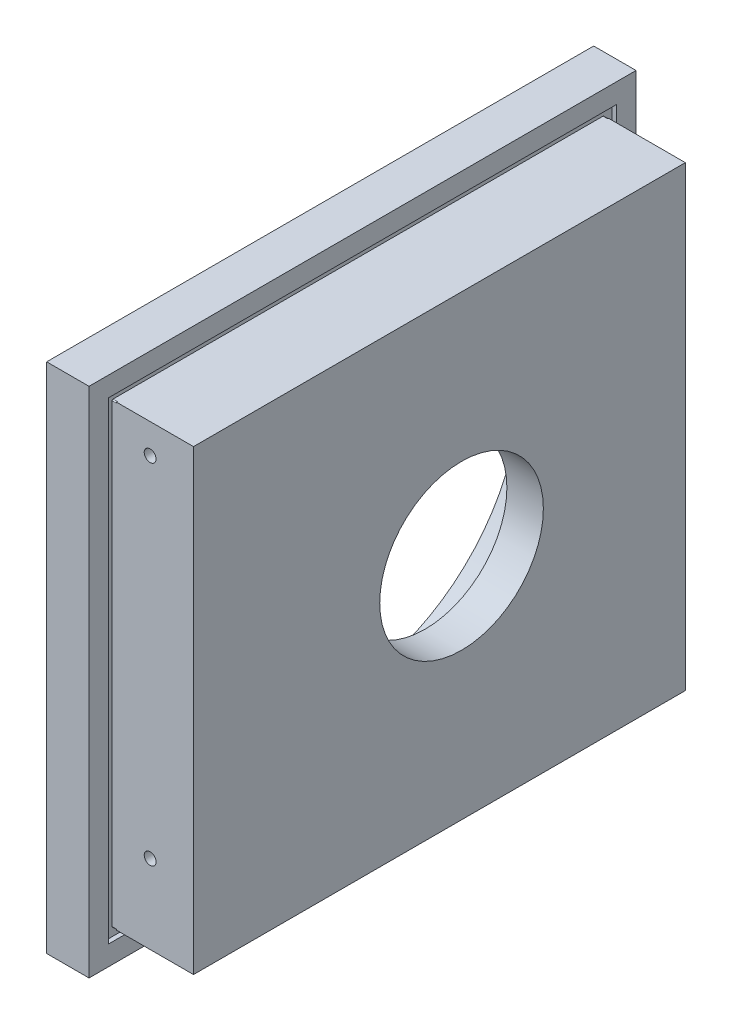
from build123d import *

# Parameters (mm, degrees)
SKETCH1_W                 = 300
SKETCH1_H                 = 260
BOSS_EXTRUDE1_DEPTH       = 60.5
SKETCH2_R                 = 90.45
CUT_EXTRUDE1_DEPTH        = 42
SKETCH9_R                 = 41.51
CUT_EXTRUDE9_DEPTH        = 306
SKETCH12_W                = 39
SKETCH12_H                = 260
CUT_EXTRUDE12_DEPTH       = 14
SKETCH13_W                = 39
SKETCH13_H                = 260
CUT_EXTRUDE13_DEPTH       = 36.45
SKETCH14_W                = 39
SKETCH14_H                = 14
CUT_EXTRUDE14_DEPTH       = 333.506014983
SKETCH15_W                = 22.45
SKETCH15_H                = 260
CUT_EXTRUDE15_DEPTH       = 208.50963833
F_6_0MM_DOWEL_HOLE1_D     = 6
F_6_0MM_DOWEL_HOLE1_DEPTH = 30
F_6_0MM_DOWEL_HOLE1_TIP   = 1.802581857
F_6_0MM_DOWEL_HOLE2_D     = 6
F_6_0MM_DOWEL_HOLE2_DEPTH = 30
F_6_0MM_DOWEL_HOLE2_TIP   = 1.802581857
F_6_0MM_DOWEL_HOLE3_D     = 6
F_6_0MM_DOWEL_HOLE3_DEPTH = 15
F_6_0MM_DOWEL_HOLE3_TIP   = 1.802581857
SKETCH25_W                = 39
SKETCH25_H                = 14
CUT_EXTRUDE16_DEPTH       = 333.506014983
SKETCH26_W                = 257.55
SKETCH26_H                = 240
CUT_EXTRUDE18_DEPTH       = 2.3
F_6_0MM_DOWEL_HOLE4_D     = 6
F_6_0MM_DOWEL_HOLE4_DEPTH = 15
F_6_0MM_DOWEL_HOLE4_TIP   = 1.802581857
SKETCH32_R                = 2.25
CUT_EXTRUDE19_DEPTH       = 57
SKETCH33_R                = 95.95
SKETCH33_R_2              = 91.95
CUT_EXTRUDE21_DEPTH       = 2.3


with BuildPart() as part:
    # Sketch1 → Boss-Extrude1 (new body)
    with BuildSketch(Plane(origin=(0, 0, 0), x_dir=(0, 0, -1), z_dir=(1, 0, 0))):
        Rectangle(SKETCH1_W, SKETCH1_H)
    extrude(amount=BOSS_EXTRUDE1_DEPTH)

    # Sketch2 → Cut-Extrude1 (cut)
    with BuildSketch(Plane(origin=(0, 0, 0), x_dir=(0, 0, -1), z_dir=(1, 0, 0))):
        with Locations(Location((0, 0, 0), (0, 0, 180))):
            Circle(SKETCH2_R)
    extrude(amount=CUT_EXTRUDE1_DEPTH, mode=Mode.SUBTRACT)

    # Sketch9 → Cut-Extrude9 (cut)
    with BuildSketch(Plane(origin=(0, 0, 0), x_dir=(0, 0, -1), z_dir=(1, 0, 0))):
        with Locations(Location((0, 0, 0), (0, 0, 180))):
            Circle(SKETCH9_R)
    extrude(amount=CUT_EXTRUDE9_DEPTH, mode=Mode.SUBTRACT)

    # Sketch12 → Cut-Extrude12 (cut)
    with BuildSketch(Plane.XY.offset(150)):
        with Locations((41, 0)):
            Rectangle(SKETCH12_W, SKETCH12_H)
    extrude(amount=-CUT_EXTRUDE12_DEPTH, mode=Mode.SUBTRACT)

    # Sketch13 → Cut-Extrude13 (cut)
    with BuildSketch(Plane(origin=(0, 0, -150), x_dir=(-1, 0, 0), z_dir=(0, 0, -1))):
        with Locations((-41, 0)):
            Rectangle(SKETCH13_W, SKETCH13_H)
    extrude(amount=-CUT_EXTRUDE13_DEPTH, mode=Mode.SUBTRACT)

    # Sketch14 → Cut-Extrude14 (cut, through all)
    with BuildSketch(Plane.XY.offset(150)):
        with Locations((41, -123)):
            Rectangle(SKETCH14_W, SKETCH14_H)
    extrude(amount=-CUT_EXTRUDE14_DEPTH, mode=Mode.SUBTRACT)

    # Sketch15 → Cut-Extrude15 (cut, through all)
    with BuildSketch(Plane(origin=(0, 0, 0), x_dir=(0, 0, -1), z_dir=(1, 0, 0))):
        with Locations((138.775, 0)):
            Rectangle(SKETCH15_W, SKETCH15_H)
    extrude(amount=CUT_EXTRUDE15_DEPTH, mode=Mode.SUBTRACT)

    # Ø6.0mm Dowel Hole1
    with Locations(Plane.XY.offset(136)):
        with Locations((38.5, 101), (38.5, -76)):
            Hole(F_6_0MM_DOWEL_HOLE1_D / 2, depth=F_6_0MM_DOWEL_HOLE1_DEPTH)
            with Locations((0, 0, -(F_6_0MM_DOWEL_HOLE1_DEPTH + F_6_0MM_DOWEL_HOLE1_TIP / 2))):  # 118° drill point
                Cone(0, F_6_0MM_DOWEL_HOLE1_D / 2, F_6_0MM_DOWEL_HOLE1_TIP, mode=Mode.SUBTRACT)

    # Ø6.0mm Dowel Hole2
    with Locations(Plane(origin=(0, 0, -113.55), x_dir=(-1, 0, 0), z_dir=(0, 0, -1))):
        with Locations((-38.5, 101), (-38.5, -76)):
            Hole(F_6_0MM_DOWEL_HOLE2_D / 2, depth=F_6_0MM_DOWEL_HOLE2_DEPTH)
            with Locations((0, 0, -(F_6_0MM_DOWEL_HOLE2_DEPTH + F_6_0MM_DOWEL_HOLE2_TIP / 2))):  # 118° drill point
                Cone(0, F_6_0MM_DOWEL_HOLE2_D / 2, F_6_0MM_DOWEL_HOLE2_TIP, mode=Mode.SUBTRACT)

    # Ø6.0mm Dowel Hole3
    with Locations(Plane(origin=(0, -116, 0), x_dir=(-1, 0, 0), z_dir=(0, -1, 0))):
        with Locations((-40, -120), (-40, 97.55)):
            Hole(F_6_0MM_DOWEL_HOLE3_D / 2, depth=F_6_0MM_DOWEL_HOLE3_DEPTH)
            with Locations((0, 0, -(F_6_0MM_DOWEL_HOLE3_DEPTH + F_6_0MM_DOWEL_HOLE3_TIP / 2))):  # 118° drill point
                Cone(0, F_6_0MM_DOWEL_HOLE3_D / 2, F_6_0MM_DOWEL_HOLE3_TIP, mode=Mode.SUBTRACT)

    # Sketch25 → Cut-Extrude16 (cut, through all)
    with BuildSketch(Plane(origin=(0, 0, -150), x_dir=(-1, 0, 0), z_dir=(0, 0, -1))):
        with Locations((-41, 123)):
            Rectangle(SKETCH25_W, SKETCH25_H)
    extrude(amount=-CUT_EXTRUDE16_DEPTH, mode=Mode.SUBTRACT)

    # Sketch26 → Cut-Extrude18 (cut)
    with BuildSketch(Plane(origin=(21.5, 0, 0), x_dir=(0, 0, -1), z_dir=(1, 0, 0))):
        with Locations((-11.225, 0)):
            Rectangle(SKETCH26_W, SKETCH26_H)
        with BuildLine():
            Line((-135.5, 116), (113.05, 116))
            ThreePointArc((113.05, 116), (113.403553391, 115.853553391), (113.55, 115.5))
            Line((113.55, 115.5), (113.55, -115.5))
            ThreePointArc((113.55, -115.5), (113.403553391, -115.853553391), (113.05, -116))
            Line((113.05, -116), (-135.5, -116))
            ThreePointArc((-135.5, -116), (-135.853553391, -115.853553391), (-136, -115.5))
            Line((-136, -115.5), (-136, 115.5))
            ThreePointArc((-136, 115.5), (-135.853553391, 115.853553391), (-135.5, 116))
        make_face(mode=Mode.SUBTRACT)
    extrude(amount=-CUT_EXTRUDE18_DEPTH, mode=Mode.SUBTRACT)

    # Ø6.0mm Dowel Hole4
    with Locations(Plane.ZY):
        with Locations((0, 107.825), (82.598742079, 69.308574014), (82.598742079, -69.308574014), (0, -107.825), (-82.598742079, -69.308574014), (-82.598742079, 69.308574014)):
            Hole(F_6_0MM_DOWEL_HOLE4_D / 2, depth=F_6_0MM_DOWEL_HOLE4_DEPTH)
            with Locations((0, 0, -(F_6_0MM_DOWEL_HOLE4_DEPTH + F_6_0MM_DOWEL_HOLE4_TIP / 2))):  # 118° drill point
                Cone(0, F_6_0MM_DOWEL_HOLE4_D / 2, F_6_0MM_DOWEL_HOLE4_TIP, mode=Mode.SUBTRACT)

    # Sketch32 → Cut-Extrude19 (cut)
    with BuildSketch(Plane(origin=(0, -130, 0), x_dir=(-1, 0, 0), z_dir=(0, -1, 0))):
        with Locations(Location((-9, -9.45, 0), (0, 0, 90))):
            Circle(SKETCH32_R)
    extrude(amount=-CUT_EXTRUDE19_DEPTH, mode=Mode.SUBTRACT)

    # Sketch33 → Cut-Extrude21 (cut)
    with BuildSketch(Plane(origin=(0, 0, 0), x_dir=(0, 0, -1), z_dir=(1, 0, 0))):
        Circle(SKETCH33_R)
        Circle(SKETCH33_R_2, mode=Mode.SUBTRACT)
    extrude(amount=CUT_EXTRUDE21_DEPTH, mode=Mode.SUBTRACT)


solid = part.part
